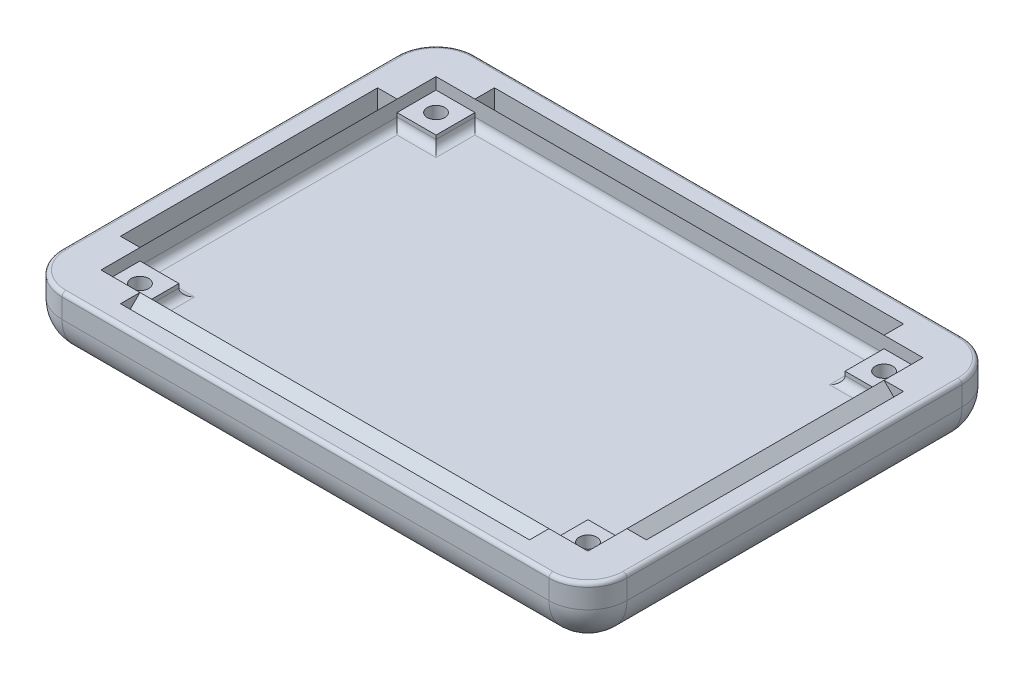
from build123d import *

# Parameters (mm, degrees)
SKETCH1_W               = 145
SKETCH1_H               = 106
BOSS_EXTRUDE1_DEPTH     = 16
CUT_EXTRUDE1_START      = 16
SKETCH1_4_W             = 125
SKETCH1_4_H             = 86
CUT_EXTRUDE1_DEPTH      = 6
CUT_EXTRUDE3_DEPTH      = 52.5
CUT_EXTRUDE4_DEPTH      = 33
FILLET1_R               = 10
SKETCH5_W               = 10
SKETCH5_H               = 10
BOSS_EXTRUDE3_DEPTH     = 3
MIRROR6_COPY_1_SKETCH_W = 10
MIRROR6_COPY_1_SKETCH_H = 10
MIRROR6_COPY_1_DEPTH    = 3
FILLET3_R               = 2
FILLET11_R              = 1


with BuildPart() as part:
    # Sketch1 → Boss-Extrude1 (new body)
    with BuildSketch(Plane(origin=(0, 0, 0), x_dir=(1, 0, 0), z_dir=(0, 1, 0))):
        Rectangle(SKETCH1_W, SKETCH1_H)
    extrude(amount=BOSS_EXTRUDE1_DEPTH)

    # Sketch1<4> → Cut-Extrude1 (cut)
    with BuildSketch(Plane(origin=(0, 0, 0), x_dir=(1, 0, 0), z_dir=(0, 1, 0)).offset(CUT_EXTRUDE1_START)):
        Rectangle(SKETCH1_4_W, SKETCH1_4_H)
    extrude(amount=-CUT_EXTRUDE1_DEPTH, mode=Mode.SUBTRACT)

    # Sketch3 → Cut-Extrude3 (cut, symmetric)
    with BuildSketch(Plane(origin=(0, 0, 0), x_dir=(0, 0, -1), z_dir=(1, 0, 0))):
        Polygon((-48, 16), (-43, 16), (-48, 11), align=None)
    cut_extrude3 = extrude(amount=CUT_EXTRUDE3_DEPTH, both=True, mode=Mode.SUBTRACT)

    # Sketch4 → Cut-Extrude4 (cut, symmetric)
    with BuildSketch(Plane.XY):
        Polygon((-62.5, 16), (-67.5, 16), (-67.5, 11), align=None)
    cut_extrude4 = extrude(amount=CUT_EXTRUDE4_DEPTH, both=True, mode=Mode.SUBTRACT)

    # Mirror1: Cut-Extrude4 across plane
    add(cut_extrude4.mirror(Plane(origin=(0, 0, 0), x_dir=(0, 0, 1), z_dir=(1, 0, 0))), mode=Mode.SUBTRACT)

    # Mirror4: Cut-Extrude3 across plane
    add(cut_extrude3.mirror(Plane.XY), mode=Mode.SUBTRACT)

    # Fillet1
    fillet1_edges = [part.edges().sort_by_distance(p)[0] for p in [
        (0, 0, -53),
        (72.5, 0, 0),
        (0, 0, 53),
        (-72.5, 0, 0),
        (-72.5, 8, -53),
        (72.5, 8, -53),
        (72.5, 8, 53),
        (-72.5, 8, 53),
    ]]
    fillet(fillet1_edges, radius=FILLET1_R)

    # Sketch5 → Boss-Extrude3 (add)
    with BuildSketch(Plane(origin=(0, 10, 0), x_dir=(1, 0, 0), z_dir=(0, 1, 0))):
        with Locations((-57.5, 38)):
            Rectangle(SKETCH5_W, SKETCH5_H)
    boss_extrude3 = extrude(amount=BOSS_EXTRUDE3_DEPTH)

    # Sketch7 → M4 Clearance Hole1 (revolve, cut)
    with BuildSketch(Plane(origin=(-57.5, 13, -38), x_dir=(0, 0, 1), z_dir=(1, 0, 0))):
        Polygon((0, 0), (0, 7.25), (2.25, 5), (2.25, 0), align=None)
    m4_clearance_hole1 = revolve(axis=Axis((-57.5, 19.35, -38), (0, -1, 0)), mode=Mode.SUBTRACT)

    # Mirror5: Boss-Extrude3, M4 Clearance Hole1 across plane
    add(boss_extrude3.mirror(Plane.XY))
    add(m4_clearance_hole1.mirror(Plane.XY), mode=Mode.SUBTRACT)

    # Mirror6: Boss-Extrude3, M4 Clearance Hole1 across plane
    add(boss_extrude3.mirror(Plane(origin=(0, 0, 0), x_dir=(0, 0, 1), z_dir=(1, 0, 0))))
    add(m4_clearance_hole1.mirror(Plane(origin=(0, 0, 0), x_dir=(0, 0, 1), z_dir=(1, 0, 0))), mode=Mode.SUBTRACT)

    # Mirror6 copy 1 sketch → Mirror6 copy 1 (add)
    with BuildSketch(Plane(origin=(0, 10, 0), x_dir=(-1, 0, 0), z_dir=(0, 1, 0))):
        with Locations((-57.5, 38)):
            Rectangle(MIRROR6_COPY_1_SKETCH_W, MIRROR6_COPY_1_SKETCH_H)
    extrude(amount=MIRROR6_COPY_1_DEPTH)

    # Mirror6 copy 2 sketch → Mirror6 copy 2 (revolve, cut)
    with BuildSketch(Plane(origin=(57.5, 13, 38), x_dir=(0, 0, -1), z_dir=(-1, 0, 0))):
        Polygon((0, 0), (0, 7.25), (2.25, 5), (2.25, 0), align=None)
    revolve(axis=Axis((57.5, 19.35, 38), (0, -1, 0)), mode=Mode.SUBTRACT)

    # Fillet3
    fillet3_edges = [part.edges().sort_by_distance(p)[0] for p in [
        (-52.5, 10, -38),
        (-57.5, 10, -33),
        (-62.5, 10, 0),
        (-57.5, 10, 33),
        (-52.5, 10, 38),
        (0, 10, -43),
        (57.5, 10, -33),
        (52.5, 10, -38),
        (0, 10, 43),
        (62.5, 10, 0),
        (52.5, 10, 38),
        (57.5, 10, 33),
    ]]
    fillet(fillet3_edges, radius=FILLET3_R)

    # Fillet11
    fillet11_edges = [part.edges().sort_by_distance(p)[0] for p in [
        (0, 16, 53),
        (72.5, 16, 0),
        (0, 16, -53),
        (-72.5, 16, 0),
        (-69.571067812, 16, 50.071067812),
        (69.571067812, 16, 50.071067812),
        (69.571067812, 16, -50.071067812),
        (-69.571067812, 16, -50.071067812),
    ]]
    fillet(fillet11_edges, radius=FILLET11_R)


solid = part.part
